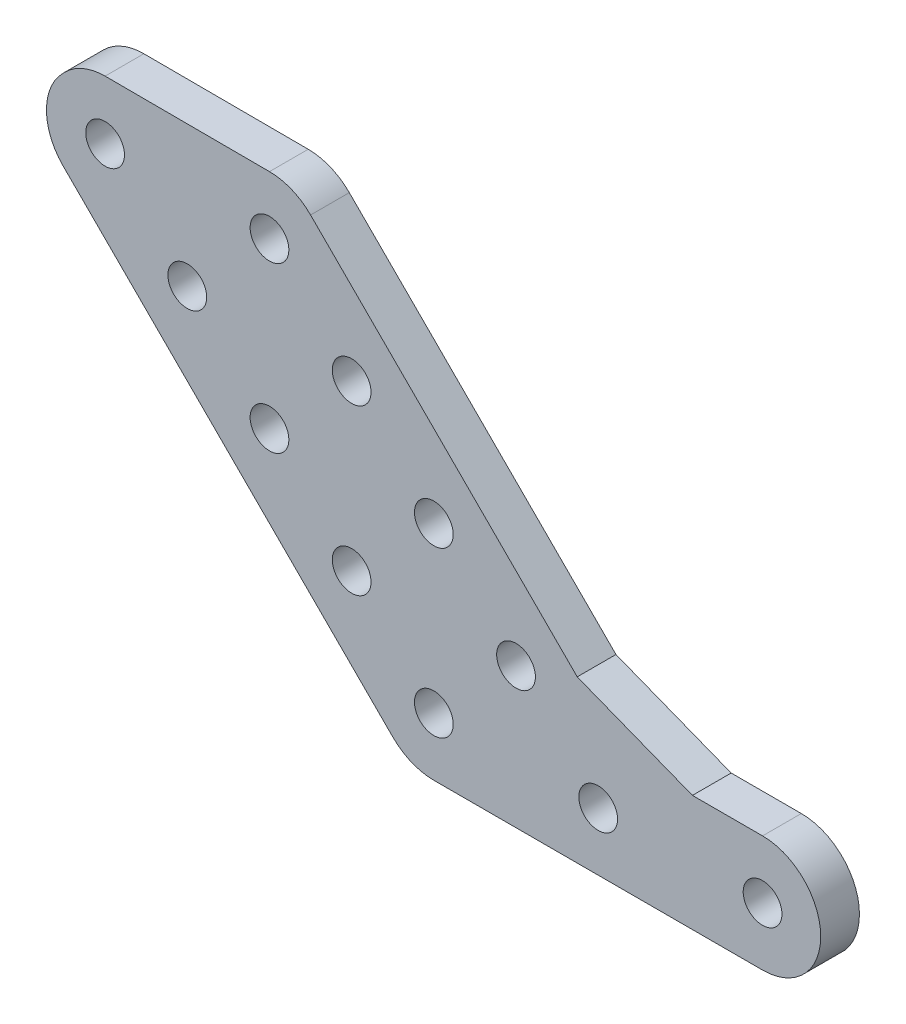
from build123d import *

# Parameters (mm, degrees)
MODEL_R                 = 1.5
SALIENTE_EXTRUIR1_DEPTH = 3


with BuildPart() as part:
    # Model → Saliente-Extruir1 (new body)
    with BuildSketch(Plane.XY):
        with BuildLine():
            Line((198.613156537, 287.328333228), (193.181176022, 287.328333228))
            Line((193.181176022, 287.328333228), (184.260234476, 290.817294259))
            Line((184.260234476, 290.817294259), (163.611370869, 311.466157866))
            ThreePointArc((163.611370869, 311.466157866), (162.151465799, 312.441635247), (160.429390353, 312.784177351))
            Line((160.429390353, 312.784177351), (147.730106437, 312.825505508))
            Line((147.730106437, 312.825505508), (147.701468292, 312.825598707))
            ThreePointArc((147.701468292, 312.825598707), (146.01766119, 312.49066865), (144.590198455, 311.536868544))
            Line((144.590198455, 311.536868544), (144.448777098, 311.395447188))
            ThreePointArc((144.448777098, 311.395447188), (143.160046936, 308.284177351), (144.448777098, 305.172907513))
            Line((144.448777098, 305.172907513), (169.975331899, 279.646352713))
            ThreePointArc((169.975331899, 279.646352713), (171.435236969, 278.670875332), (173.157312415, 278.328333228))
            Line((173.157312415, 278.328333228), (198.613156537, 278.328333228))
            ThreePointArc((198.613156537, 278.328333228), (203.113156537, 282.828333228), (198.613156537, 287.328333228))
        make_face()
        with Locations((166.793351384, 289.192294259)):
            Circle(MODEL_R, mode=Mode.SUBTRACT)
        with Locations((160.429390353, 295.556255289)):
            Circle(MODEL_R, mode=Mode.SUBTRACT)
        with Locations((173.157312415, 282.828333228)):
            Circle(MODEL_R, mode=Mode.SUBTRACT)
        with Locations((185.885234476, 282.828333228)):
            Circle(MODEL_R, mode=Mode.SUBTRACT)
        with Locations((198.613156537, 282.828333228)):
            Circle(MODEL_R, mode=Mode.SUBTRACT)
        with Locations((179.521273445, 289.192294259)):
            Circle(MODEL_R, mode=Mode.SUBTRACT)
        with Locations((173.157312415, 295.556255289)):
            Circle(MODEL_R, mode=Mode.SUBTRACT)
        with Locations((154.065429323, 301.92021632)):
            Circle(MODEL_R, mode=Mode.SUBTRACT)
        with Locations((166.793351384, 301.92021632)):
            Circle(MODEL_R, mode=Mode.SUBTRACT)
        with Locations((147.701468292, 308.284177351)):
            Circle(MODEL_R, mode=Mode.SUBTRACT)
        with Locations((160.429390353, 308.284177351)):
            Circle(MODEL_R, mode=Mode.SUBTRACT)
    extrude(amount=SALIENTE_EXTRUIR1_DEPTH)


solid = part.part
